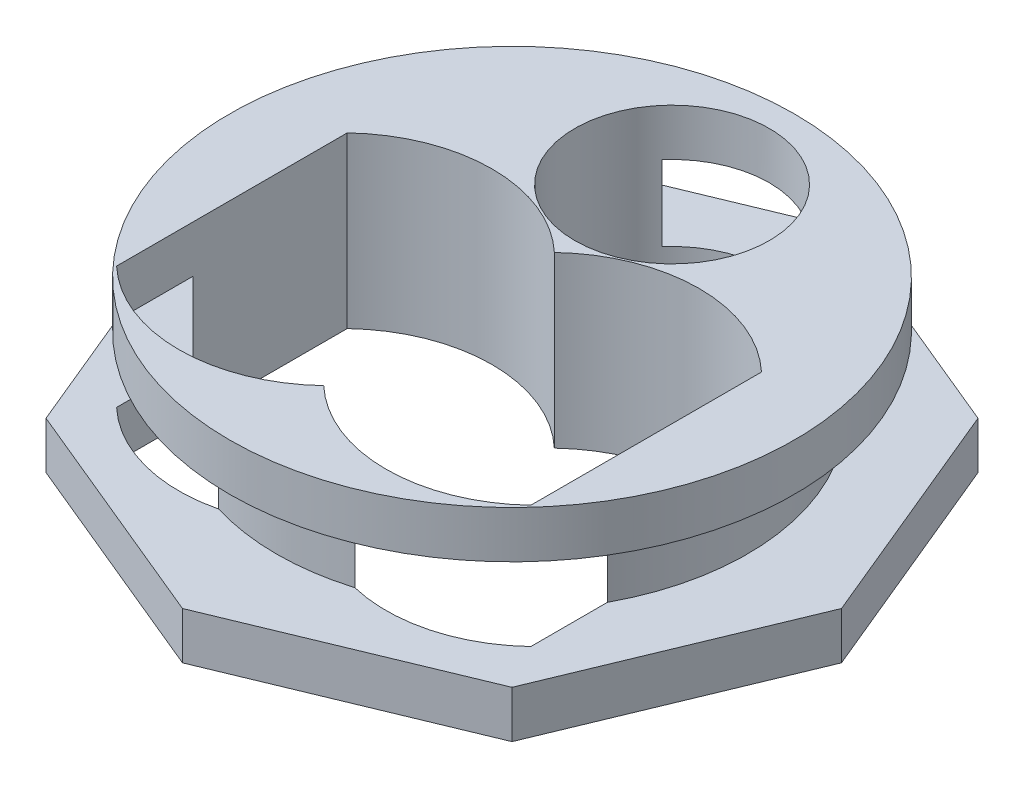
from build123d import *

# Parameters (mm, degrees)
BOSS_EXTRUDE1_DEPTH     = 5
SKETCH12_R              = 25
BOSS_EXTRUDE2_DEPTH     = 8
CUT_EXTRUDE6_DEPTH      = 9.856111051
CUT_EXTRUDE6_DEPTH_BACK = 25
SKETCH17_R              = 10.33
SKETCH25_R              = 30
BOSS_EXTRUDE3_DEPTH     = 5
SKETCH26_R              = 10.33
CUT_EXTRUDE9_DEPTH      = 5
CUT_EXTRUDE10_DEPTH     = 45


with BuildPart() as part:
    # Sketch3 → Boss-Extrude1 (new body)
    with BuildSketch(Plane(origin=(0, 0, 0), x_dir=(1, 0, 0), z_dir=(0, 1, 0))):
        Polygon((35, 0), (24.748737342, 24.748737342), (0, 35), (-24.748737342, 24.748737342), (-35, 0), (-24.748737342, -24.748737342), (0, -35), (24.748737342, -24.748737342), align=None)
    extrude(amount=BOSS_EXTRUDE1_DEPTH)

    # Sketch12 → Boss-Extrude2 (add)
    with BuildSketch(Plane(origin=(0, 5, 0), x_dir=(1, 0, 0), z_dir=(0, 1, 0))):
        Circle(SKETCH12_R)
    extrude(amount=BOSS_EXTRUDE2_DEPTH)

    # Sketch17 → Cut-Extrude6 (cut, two sides: drawn at the far end of the back side and taken through both)
    with BuildSketch(Plane(origin=(0, 13, 0), x_dir=(1, 0, 0), z_dir=(0, 1, 0)).offset(-CUT_EXTRUDE6_DEPTH_BACK)):
        with Locations((0, 17)):
            Circle(SKETCH17_R)
    extrude(amount=CUT_EXTRUDE6_DEPTH + CUT_EXTRUDE6_DEPTH_BACK, mode=Mode.SUBTRACT)

    # Sketch25 → Boss-Extrude3 (add)
    with BuildSketch(Plane(origin=(0, 13, 0), x_dir=(1, 0, 0), z_dir=(0, 1, 0))):
        Circle(SKETCH25_R)
    extrude(amount=BOSS_EXTRUDE3_DEPTH)

    # Sketch26 → Cut-Extrude9 (cut)
    with BuildSketch(Plane(origin=(0, 18, 0), x_dir=(1, 0, 0), z_dir=(0, 1, 0))):
        with Locations((0, 17)):
            Circle(SKETCH26_R)
    extrude(amount=-CUT_EXTRUDE9_DEPTH, mode=Mode.SUBTRACT)

    # Sketch27 → Cut-Extrude10 (cut)
    with BuildSketch(Plane(origin=(0, 18, 0), x_dir=(1, 0, 0), z_dir=(0, 1, 0))):
        with BuildLine():
            Line((0, -20), (0, 4.5))
            ThreePointArc((0, 4.5), (-11, 8.881049961), (-22, 4.5))
            Line((-22, 4.5), (-22, -20))
            ThreePointArc((-22, -20), (-11, -24.381049961), (0, -20))
        make_face()
    cut_extrude10 = extrude(amount=-CUT_EXTRUDE10_DEPTH, mode=Mode.SUBTRACT)

    # Mirror8: Cut-Extrude10 across plane
    add(cut_extrude10.mirror(Plane.ZY), mode=Mode.SUBTRACT)


solid = part.part
